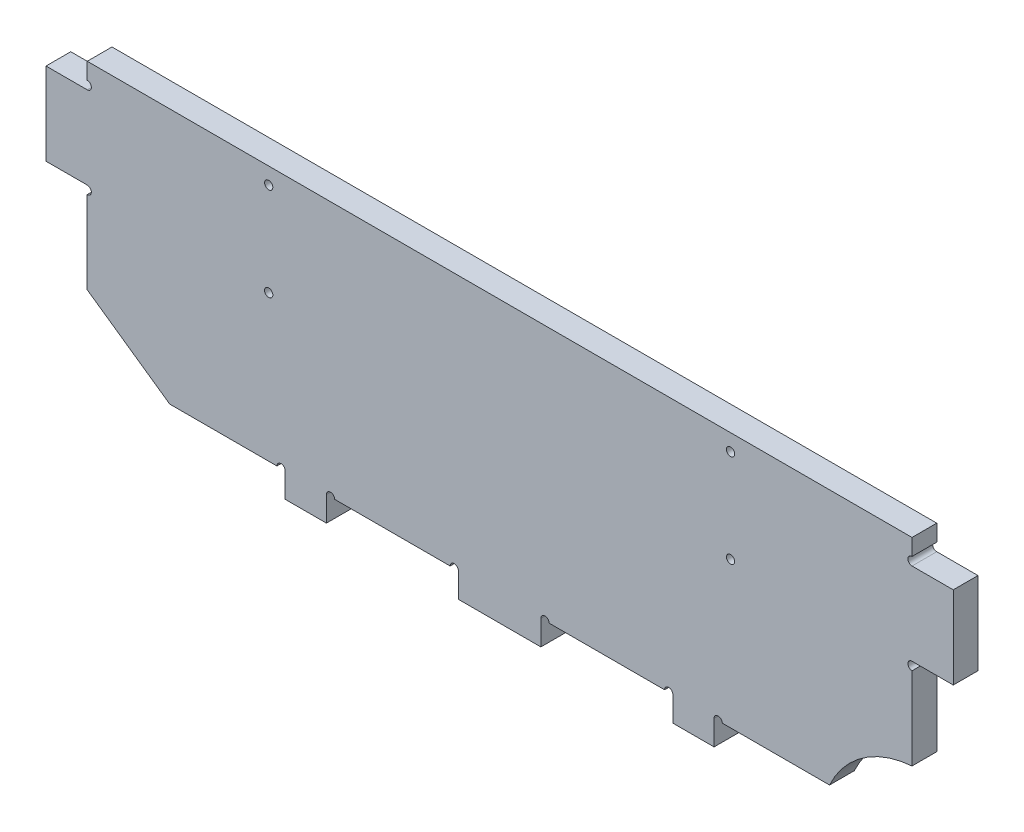
from build123d import *

# Parameters (mm, degrees)
SKETCH1_R           = 0.5
BOSS_EXTRUDE1_DEPTH = 3
CUT_EXTRUDE2_DEPTH  = 65.730209331


with BuildPart() as part:
    # Sketch1 → Boss-Extrude1 (new body)
    with BuildSketch(Plane.XY):
        with BuildLine():
            Line((-5, 0), (5, 0))
            Line((5, 0), (5, 3))
            Line((5, 3), (21, 3))
            Line((21, 3), (21, 0))
            Line((21, 0), (26, 0))
            Line((26, 0), (26, 3))
            Line((26, 3), (40, 3))
            ThreePointArc((40, 3), (44.043458593, 7.866487724), (50, 10))
            Line((50, 10), (50, 21))
            Line((50, 21), (55, 21))
            Line((55, 21), (55, 31))
            Line((55, 31), (50, 31))
            Line((50, 31), (50, 34))
            Line((50, 34), (0, 34))
            Line((0, 34), (-50, 34))
            Line((-50, 34), (-50, 31))
            Line((-50, 31), (-55, 31))
            Line((-55, 31), (-55, 21))
            Line((-55, 21), (-50, 21))
            Line((-50, 21), (-50, 10))
            Line((-50, 10), (-40, 3))
            Line((-40, 3), (-26, 3))
            Line((-26, 3), (-26, 0))
            Line((-26, 0), (-21, 0))
            Line((-21, 0), (-21, 3))
            Line((-21, 3), (-5, 3))
            Line((-5, 3), (-5, 0))
        make_face()
        with Locations((28, 32)):
            Circle(SKETCH1_R, mode=Mode.SUBTRACT)
        with Locations((28, 20.7)):
            Circle(SKETCH1_R, mode=Mode.SUBTRACT)
        with Locations(Location((-28, 20.7, 0), (0, 0, 180))):
            Circle(SKETCH1_R, mode=Mode.SUBTRACT)
        with Locations(Location((-28, 32, 0), (0, 0, 180))):
            Circle(SKETCH1_R, mode=Mode.SUBTRACT)
    extrude(amount=BOSS_EXTRUDE1_DEPTH)

    # Sketch3 → Cut-Extrude2 (cut, through all)
    with BuildSketch(Plane.XY.offset(3)):
        with BuildLine():
            Line((-50, 32), (-50, 31))
            ThreePointArc((-50, 31), (-49.5, 31.5), (-50, 32))
        make_face()
        with BuildLine():
            ThreePointArc((-50, 20), (-49.5, 20.5), (-50, 21))
            Line((-50, 21), (-50, 20))
        make_face()
        with BuildLine():
            Line((-27, 3), (-26, 3))
            ThreePointArc((-26, 3), (-26.5, 3.5), (-27, 3))
        make_face()
        with BuildLine():
            ThreePointArc((-20, 3), (-20.5, 3.5), (-21, 3))
            Line((-21, 3), (-20, 3))
        make_face()
        with BuildLine():
            ThreePointArc((-5, 3), (-5.5, 3.5), (-6, 3))
            Line((-6, 3), (-5, 3))
        make_face()
        with BuildLine():
            ThreePointArc((6, 3), (5.5, 3.5), (5, 3))
            Line((5, 3), (6, 3))
        make_face()
        with BuildLine():
            ThreePointArc((21, 3), (20.5, 3.5), (20, 3))
            Line((20, 3), (21, 3))
        make_face()
        with BuildLine():
            ThreePointArc((27, 3), (26.5, 3.5), (26, 3))
            Line((26, 3), (27, 3))
        make_face()
        with BuildLine():
            Line((50, 20), (50, 21))
            ThreePointArc((50, 21), (49.5, 20.5), (50, 20))
        make_face()
        with BuildLine():
            ThreePointArc((50, 32), (49.5, 31.5), (50, 31))
            Line((50, 31), (50, 32))
        make_face()
    extrude(amount=-CUT_EXTRUDE2_DEPTH, mode=Mode.SUBTRACT)


solid = part.part
